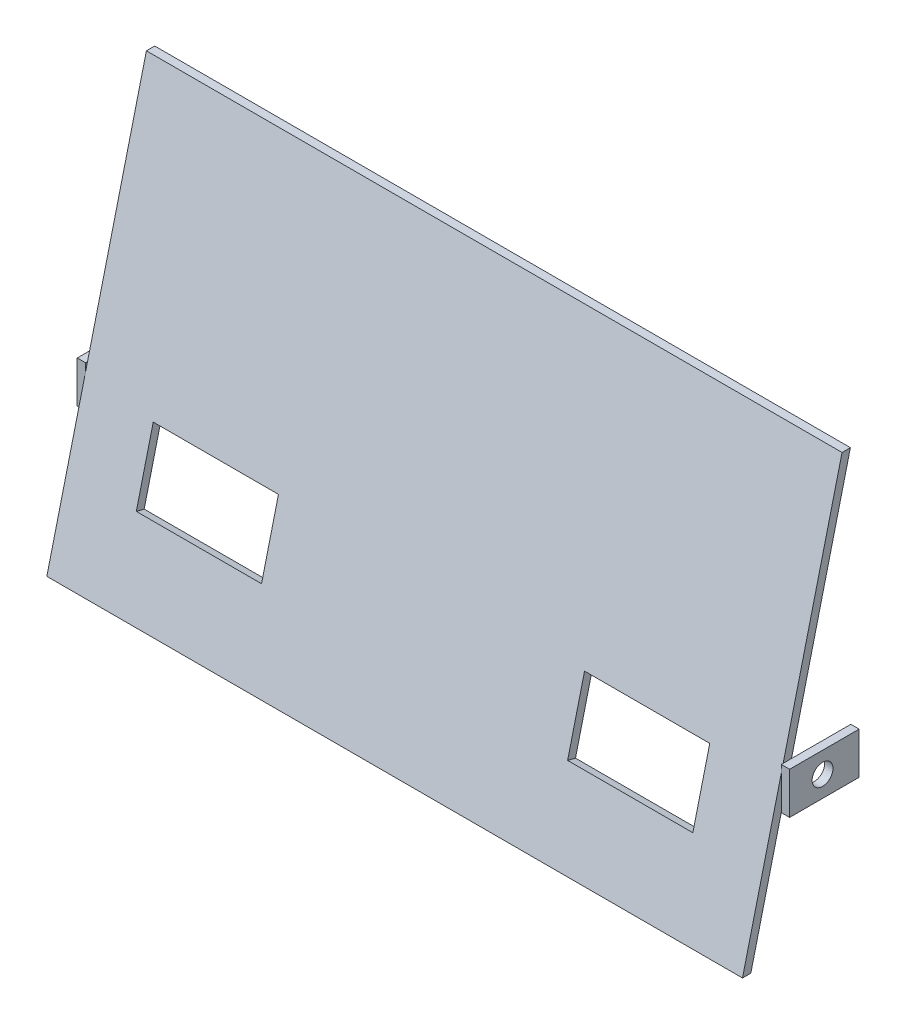
from build123d import *

# Parameters (mm, degrees)
SALIENTE_EXTRUIR1_DEPTH = 100
CROQUIS3_W              = 10
CROQUIS3_H              = 6
SALIENTE_EXTRUIR2_DEPTH = 1.2
CROQUIS4_W              = 10
CROQUIS4_H              = 6
SALIENTE_EXTRUIR3_DEPTH = 1.2
CROQUIS5_R              = 1.5
CORTAR_EXTRUIR1_DEPTH   = 119.841982146
CROQUIS6_W              = 18
CROQUIS6_H              = 10.2
CORTAR_EXTRUIR2_DEPTH   = 14


with BuildPart() as part:
    # Croquis1 → Saliente-Extruir1 (new body)
    with BuildSketch(Plane(origin=(0, 0, 0), x_dir=(0, 0, -1), z_dir=(1, 0, 0))):
        Polygon((0, 0), (1.2, 0), (15.512007455, 58.268056795), (14.312007455, 58.268056795), align=None)
    extrude(amount=-SALIENTE_EXTRUIR1_DEPTH)

    # Croquis3 → Saliente-Extruir2 (add)
    with BuildSketch(Plane(origin=(0, 0, 0), x_dir=(0, 0, -1), z_dir=(1, 0, 0))):
        with Locations((10.572099341, 20.8)):
            Rectangle(CROQUIS3_W, CROQUIS3_H)
    extrude(amount=SALIENTE_EXTRUIR2_DEPTH)

    # Croquis4 → Saliente-Extruir3 (add)
    with BuildSketch(Plane.ZY.offset(100)):
        with Locations((-10.572099341, 20.8)):
            Rectangle(CROQUIS4_W, CROQUIS4_H)
    extrude(amount=SALIENTE_EXTRUIR3_DEPTH)

    # Croquis5 → Cortar-Extruir1 (cut, through all)
    with BuildSketch(Plane(origin=(1.2, 0, 0), x_dir=(0, 0, -1), z_dir=(1, 0, 0))):
        with Locations((10.308970016, 20.8)):
            Circle(CROQUIS5_R)
    extrude(amount=-CORTAR_EXTRUIR1_DEPTH, mode=Mode.SUBTRACT)

    # Croquis6 → Cortar-Extruir2 (cut)
    with BuildSketch(Plane(origin=(0, 0, 0), x_dir=(1, 0, 0), z_dir=(0, 0.2385334575785815, 0.971134279909636))):
        with Locations((-81, 17.1)):
            Rectangle(CROQUIS6_W, CROQUIS6_H)
        with Locations((-19, 17.1)):
            Rectangle(CROQUIS6_W, CROQUIS6_H)
    extrude(amount=-CORTAR_EXTRUIR2_DEPTH, mode=Mode.SUBTRACT)


solid = part.part
